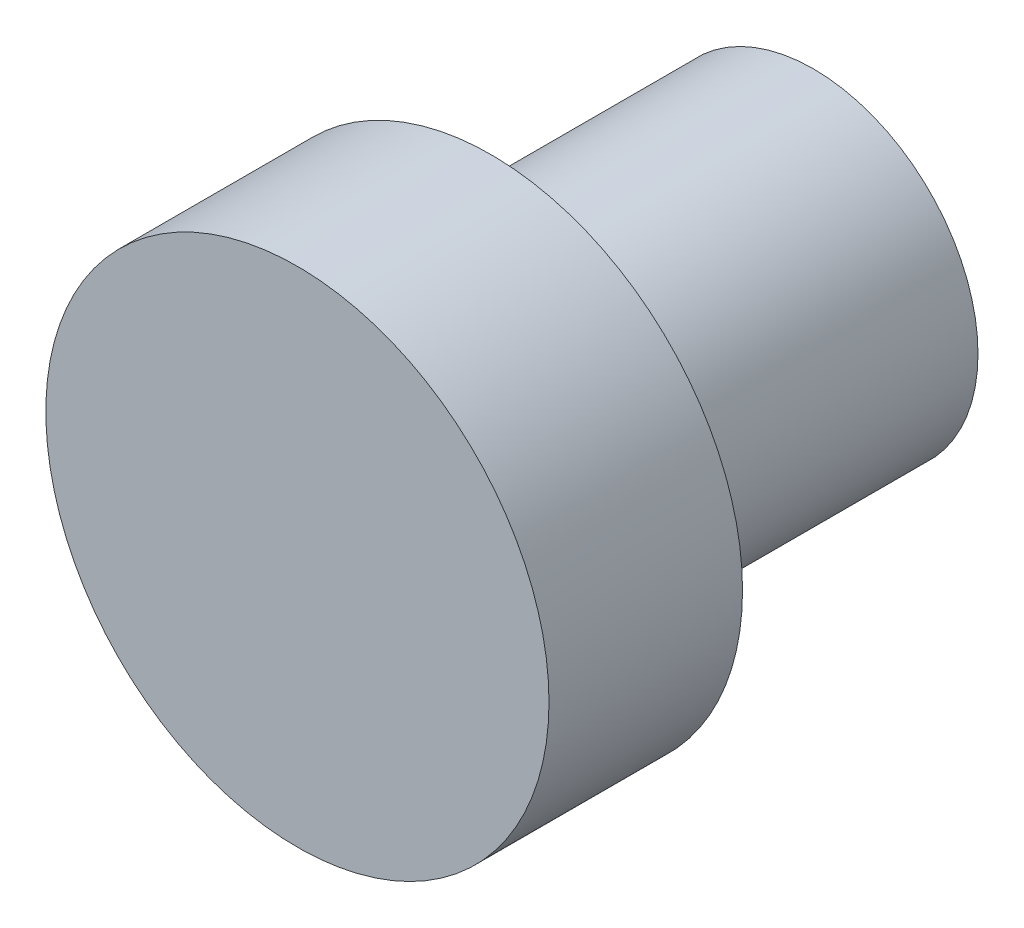
from build123d import *

# Parameters (mm, degrees)
SKIZZE1_R                       = 2.55
AUFSATZ_LINEAR_AUSTRAGEN1_DEPTH = 8
SKIZZE2_R                       = 3.9
AUFSATZ_LINEAR_AUSTRAGEN2_DEPTH = 3


with BuildPart() as part:
    # Skizze1 → Aufsatz-Linear austragen1 (new body)
    with BuildSketch(Plane.XY):
        Circle(SKIZZE1_R)
    extrude(amount=AUFSATZ_LINEAR_AUSTRAGEN1_DEPTH)

    # Skizze2 → Aufsatz-Linear austragen2 (add)
    with BuildSketch(Plane.XY.offset(8)):
        Circle(SKIZZE2_R)
    extrude(amount=-AUFSATZ_LINEAR_AUSTRAGEN2_DEPTH)


solid = part.part
